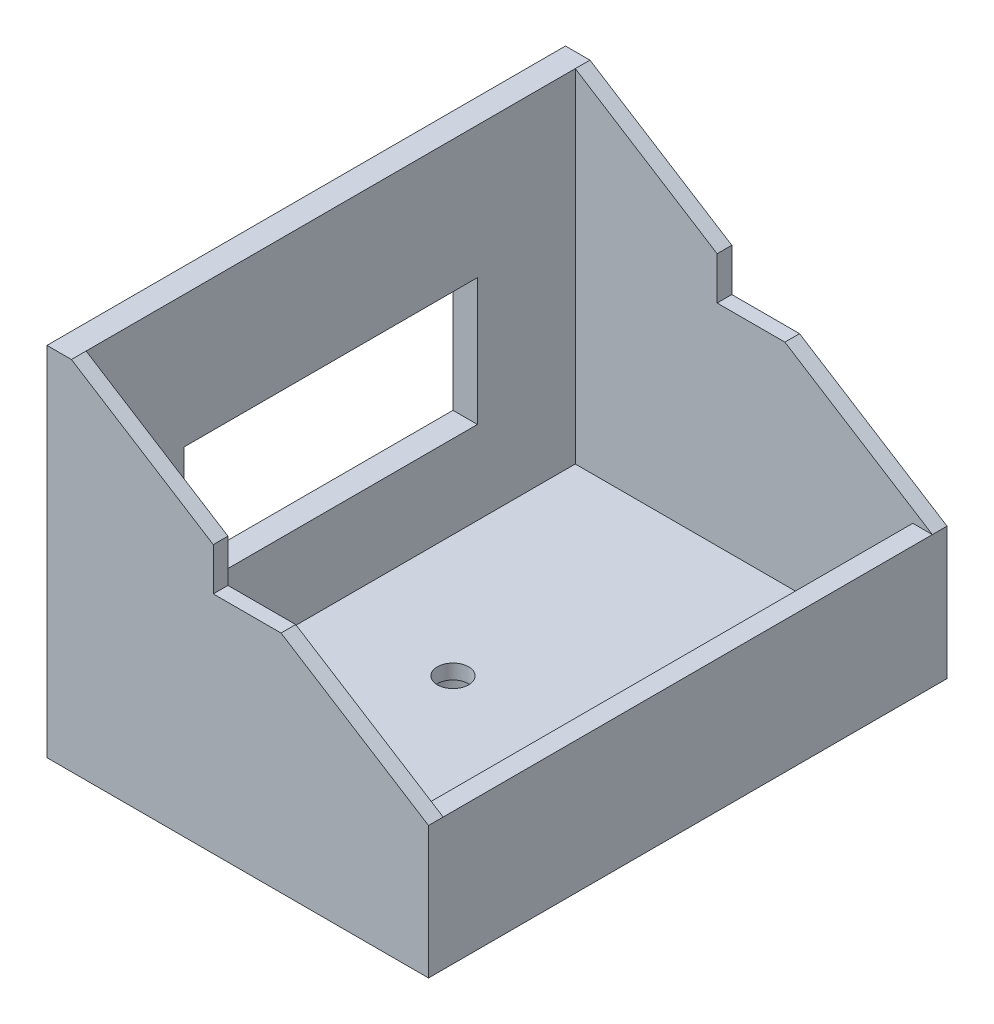
from build123d import *

# Parameters (mm, degrees)
SKETCH_1_R               = 4.5
SKETCH_1_R_2             = 3.1
EXTRUDE_1_DEPTH          = 14.3
EXTRUDE_START            = -11.25
EXTRUDE_2_DEPTH          = 11.25
SKETCH_4_W               = 30
SKETCH_4_H               = 50
EXTRUDE_3_DEPTH          = 1.5
SKETCH_5_R               = 1.6
CUT_EXTRUDE_2_DEPTH      = 34.160820255
SKETCH_6_W               = 2.5
SKETCH_6_H               = 50
EXTRUDE_4_DEPTH          = 35
SKETCH_7_W               = 30
SKETCH_7_H               = 13
CUT_EXTRUDE_3_DEPTH      = 10
CUT_EXTRUDE_4_DEPTH      = 59.571665505
CUT_EXTRUDE_4_DEPTH_BACK = 59.571665505
SKETCH_9_R               = 1.55
SKETCH_10_W              = 50
SKETCH_10_H              = 1.5
EXTRUDE_6_DEPTH          = 9
SKETCH_12_W              = 2
SKETCH_12_H              = 50
EXTRUDE_7_DEPTH          = 12
EXTRUDE_8_DEPTH          = 1.5
SKETCH_14_W              = 22
SKETCH_14_H              = 13.5
CUT_EXTRUDE_5_DEPTH      = 78.237555632


with BuildPart() as part:
    # 草图1 → 凸台-拉伸1 (new body)
    with BuildSketch(Plane(origin=(0, 0, 0), x_dir=(1, 0, 0), z_dir=(0, 1, 0))):
        with Locations(Location((0, 0, 0), (0, 0, 270))):
            Circle(SKETCH_1_R)
        with Locations(Location((0, 0, 0), (0, 0, 270))):
            Circle(SKETCH_1_R_2, mode=Mode.SUBTRACT)
    extrude(amount=EXTRUDE_1_DEPTH)

    # 草图2 → 凸台-拉伸2 (add)
    with BuildSketch(Plane(origin=(0, 14.3, 0), x_dir=(1, 0, 0), z_dir=(0, 1, 0)).offset(EXTRUDE_START)):
        with BuildLine():
            Line((2.6, 1.688194302), (2.6, -1.688194302))
            ThreePointArc((2.6, -1.688194302), (3.1, 0), (2.6, 1.688194302))
        make_face()
    extrude(amount=EXTRUDE_2_DEPTH)

    # 草图4 → 凸台-拉伸3 (add)
    with BuildSketch(Plane(origin=(0, 14.3, 0), x_dir=(1, 0, 0), z_dir=(0, 1, 0))):
        Rectangle(SKETCH_4_W, SKETCH_4_H)
    extrude(amount=EXTRUDE_3_DEPTH)

    # 草图5 → 切除-拉伸2 (cut, through all)
    with BuildSketch(Plane(origin=(0, 15.8, 0), x_dir=(1, 0, 0), z_dir=(0, 1, 0))):
        with Locations(Location((0, 0, 0), (0, 0, 270))):
            Circle(SKETCH_5_R)
    extrude(amount=-CUT_EXTRUDE_2_DEPTH, mode=Mode.SUBTRACT)

    # 草图6 → 凸台-拉伸4 (add)
    with BuildSketch(Plane(origin=(0, 15.8, 0), x_dir=(1, 0, 0), z_dir=(0, 1, 0))):
        with Locations((-13.75, 0)):
            Rectangle(SKETCH_6_W, SKETCH_6_H)
    extrude(amount=EXTRUDE_4_DEPTH)

    # 草图7 → 切除-拉伸3 (cut)
    with BuildSketch(Plane(origin=(-12.5, 0, 0), x_dir=(0, 0, -1), z_dir=(1, 0, 0))):
        with Locations((0, 30.8)):
            Rectangle(SKETCH_7_W, SKETCH_7_H)
    extrude(amount=-CUT_EXTRUDE_3_DEPTH, mode=Mode.SUBTRACT)

    # 草图9 → 切除-拉伸4 (cut, two sides: drawn at the far end of the back side and taken through both)
    with BuildSketch(Plane(origin=(0, 0, 0), x_dir=(0, 0, -1), z_dir=(1, 0, 0)).offset(-CUT_EXTRUDE_4_DEPTH_BACK)):
        with Locations((0, 5.3)):
            Circle(SKETCH_9_R)
    extrude(amount=CUT_EXTRUDE_4_DEPTH + CUT_EXTRUDE_4_DEPTH_BACK, mode=Mode.SUBTRACT)

    # 草图10 → 凸台-拉伸6 (add)
    with BuildSketch(Plane(origin=(15, 0, 0), x_dir=(0, 0, -1), z_dir=(1, 0, 0))):
        with Locations((0, 15.05)):
            Rectangle(SKETCH_10_W, SKETCH_10_H)
    extrude(amount=EXTRUDE_6_DEPTH)

    # 草图12 → 凸台-拉伸7 (add)
    with BuildSketch(Plane(origin=(0, 15.8, 0), x_dir=(1, 0, 0), z_dir=(0, 1, 0))):
        with Locations((23, 0)):
            Rectangle(SKETCH_12_W, SKETCH_12_H)
    extrude(amount=EXTRUDE_7_DEPTH)

    # 草图13 → 凸台-拉伸8 (add)
    with BuildSketch(Plane.XY.offset(25)):
        Polygon((24, 27.8), (-12.5, 50.8), (-15, 50.8), (-15, 14.3), (24, 14.3), align=None)
    extrude_8 = extrude(amount=EXTRUDE_8_DEPTH)

    # 镜向2: 凸台-拉伸8 across plane
    add(extrude_8.mirror(Plane.XY))

    # 草图14 → 切除-拉伸5 (cut, through all)
    with BuildSketch(Plane(origin=(0, 0, -26.5), x_dir=(-1, 0, 0), z_dir=(0, 0, -1))):
        with Locations((-13, 44.05)):
            Rectangle(SKETCH_14_W, SKETCH_14_H)
    extrude(amount=-CUT_EXTRUDE_5_DEPTH, mode=Mode.SUBTRACT)


solid = part.part
